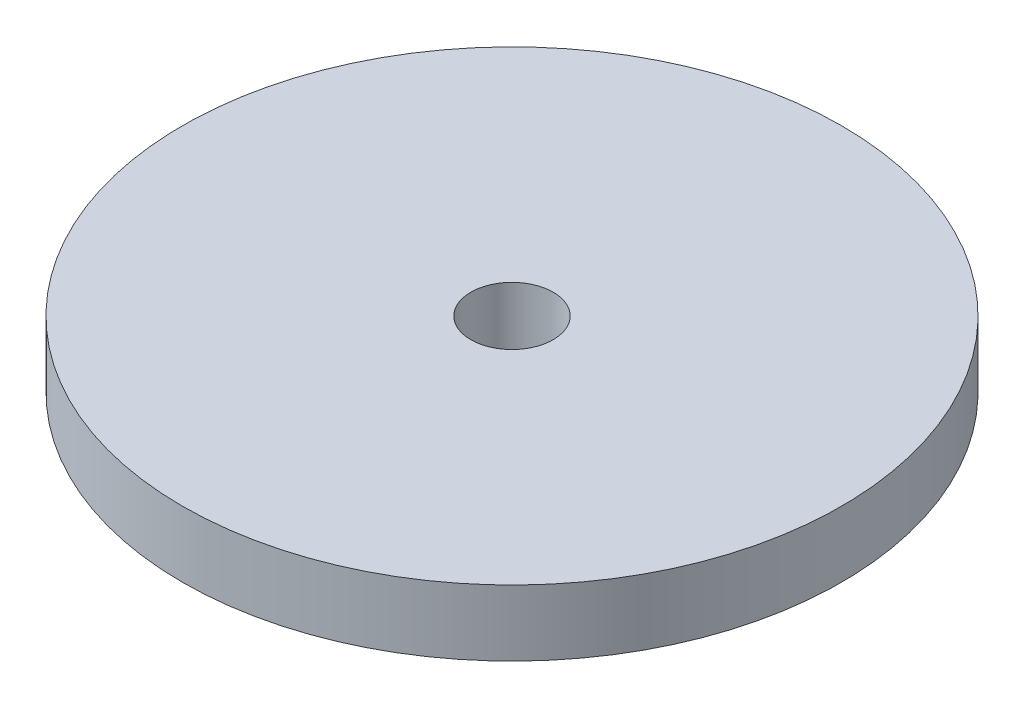
from build123d import *

# Parameters (mm, degrees)
SKETCH1_R           = 38.1
BOSS_EXTRUDE1_DEPTH = 7.62
SKETCH2_R           = 4.7625
CUT_EXTRUDE1_DEPTH  = 7.62


with BuildPart() as part:
    # Sketch1 → Boss-Extrude1 (new body)
    with BuildSketch(Plane(origin=(0, 0, 0), x_dir=(1, 0, 0), z_dir=(0, 1, 0))):
        with Locations(Location((0, 0, 0), (0, 0, 90))):
            Circle(SKETCH1_R)
    extrude(amount=BOSS_EXTRUDE1_DEPTH)

    # Sketch2 → Cut-Extrude1 (cut)
    with BuildSketch(Plane(origin=(0, 7.62, 0), x_dir=(1, 0, 0), z_dir=(0, 1, 0))):
        with Locations(Location((0, 0, 0), (0, 0, 270))):
            Circle(SKETCH2_R)
    extrude(amount=-CUT_EXTRUDE1_DEPTH, mode=Mode.SUBTRACT)


solid = part.part
